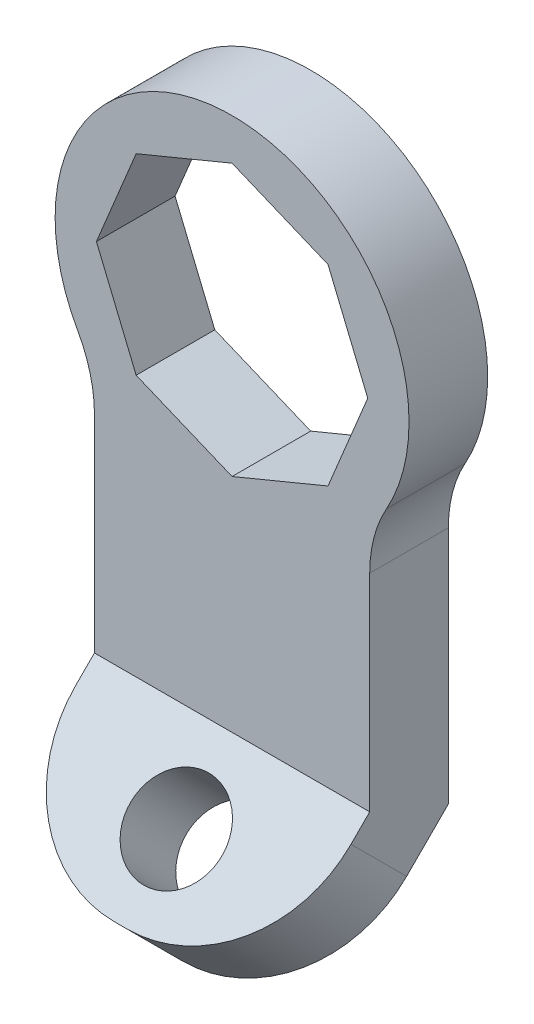
from build123d import *

# Parameters (mm, degrees)
SKETCH_1_R               = 13.5
EXTRUDE_1_DEPTH          = 6
EXTRUDE_START            = -6
EXTRUDE_2_DEPTH          = 6
EXTRUDE_3_DEPTH          = 21
SKETCH_5_R               = 3.5
CUT_EXTRUDE_1_DEPTH      = 41.943558712
CUT_EXTRUDE_3_DEPTH      = 49.849257927
CUT_EXTRUDE_3_DEPTH_BACK = 49.849257927
FILLET_3_R               = 10


with BuildPart() as part:
    # 草图1 → 凸台-拉伸1 (new body)
    with BuildSketch(Plane.XY):
        Circle(SKETCH_1_R)
        Polygon((10.35, 0), (7.318555185, -7.318555185), (0, -10.35), (-7.318555185, -7.318555185), (-10.35, 0), (-7.318555185, 7.318555185), (0, 10.35), (7.318555185, 7.318555185), align=None, mode=Mode.SUBTRACT)
    extrude(amount=EXTRUDE_1_DEPTH)

    # 草图2 → 凸台-拉伸2 (add)
    with BuildSketch(Plane.XY.offset(6).offset(EXTRUDE_START)):
        with BuildLine():
            Line((-10.5, -8.485281374), (-10.5, -30))
            Line((-10.5, -30), (10.5, -30))
            Line((10.5, -30), (10.5, -8.485281374))
            ThreePointArc((10.5, -8.485281374), (0, -13.5), (-10.5, -8.485281374))
        make_face()
    extrude(amount=EXTRUDE_2_DEPTH)

    # 草图4 → 凸台-拉伸3 (add)
    with BuildSketch(Plane(origin=(10.5, 0, 0), x_dir=(0, 0, -1), z_dir=(1, 0, 0))):
        Polygon((-6, -27.257359313), (-14.5, -35.757359313), (-10.257359313, -40), (0, -29.742640687), align=None)
    extrude(amount=-EXTRUDE_3_DEPTH)

    # 草图5 → 切除-拉伸1 (cut, through all)
    with BuildSketch(Plane(origin=(0, -10.628679656, -10.628679656), x_dir=(1, 0, 0), z_dir=(0, 0.7071067811865436, 0.7071067811865515))):
        with Locations(Location((0, -29.537319575, 0), (0, 0, 270))):
            Circle(SKETCH_5_R)
    extrude(amount=-CUT_EXTRUDE_1_DEPTH, mode=Mode.SUBTRACT)

    # 草图6 → 切除-拉伸3 (cut, two sides: drawn at the far end of the back side and taken through both)
    with BuildSketch(Plane(origin=(10.5, 0, 0), x_dir=(0, 0, -1), z_dir=(1, 0, 0)).offset(-CUT_EXTRUDE_3_DEPTH_BACK)):
        Polygon((0, -29.742640687), (-0.257359313, -30), (0, -30), align=None)
    extrude(amount=CUT_EXTRUDE_3_DEPTH + CUT_EXTRUDE_3_DEPTH_BACK, mode=Mode.SUBTRACT)

    # 圆角3
    fillet_3_edges = [part.edges().sort_by_distance(p)[0] for p in [
        (-10.5, -8.485281374, 3),
        (10.5, -8.485281374, 3),
        (-10.5, -37.878679656, 12.378679656),
        (10.5, -37.878679656, 12.378679656),
    ]]
    fillet(fillet_3_edges, radius=FILLET_3_R)


solid = part.part
